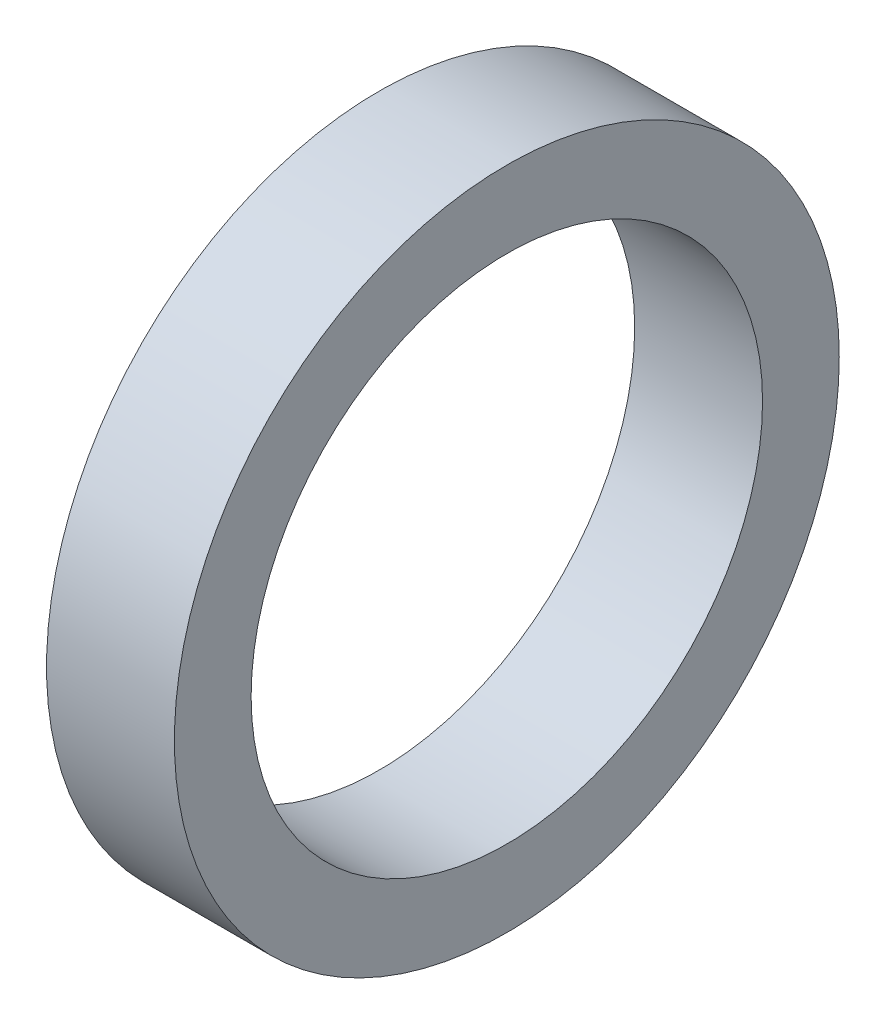
from build123d import *

# Parameters (mm, degrees)
SKETCH_1_W = 5
SKETCH_1_H = 3


with BuildPart() as part:
    # 草图1 → 旋转1 (revolve)
    with BuildSketch(Plane.XY, mode=Mode.PRIVATE) as revolve_1_sk:
        with Locations((2.5, 11.5)):
            Rectangle(SKETCH_1_W, SKETCH_1_H)
    revolve(revolve_1_sk.sketch.rotate(Axis((0, 0, 0), (-1, 0, 0)), 90), axis=Axis((0, 0, 0), (-1, 0, 0)))


solid = part.part
